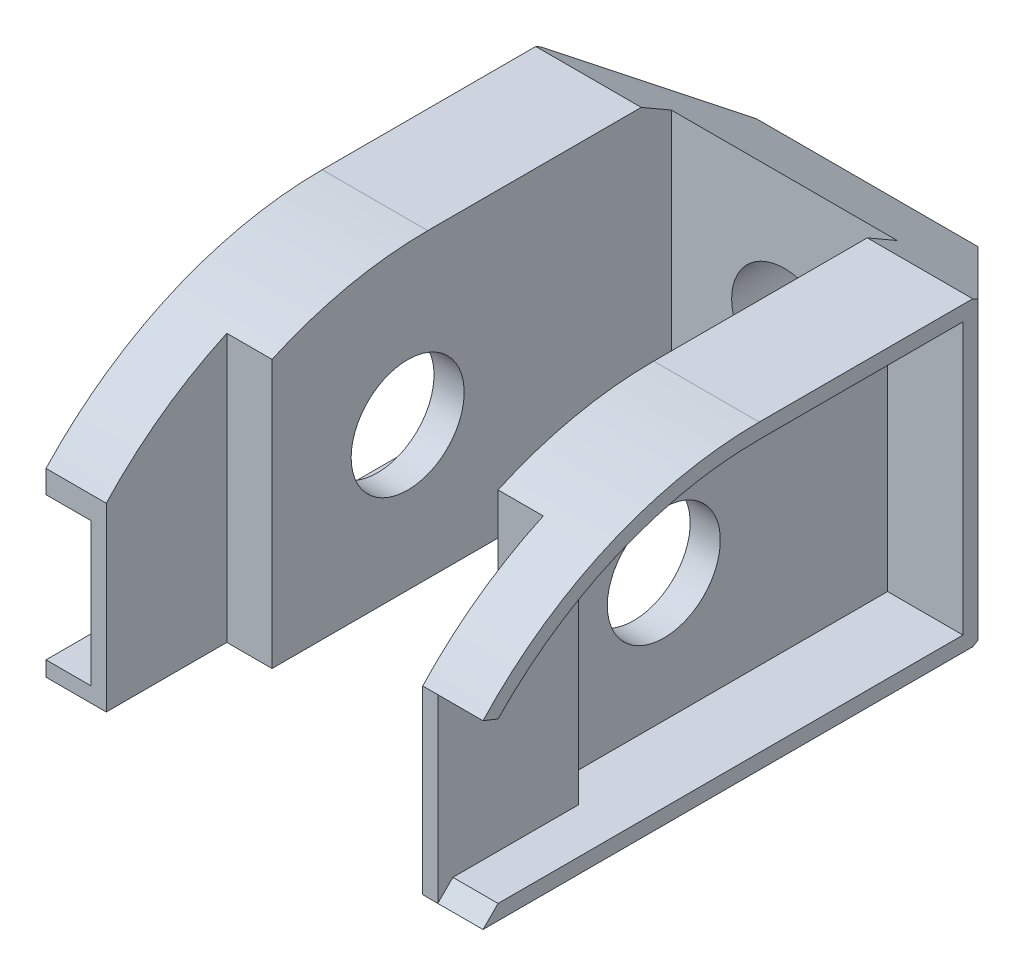
from build123d import *

# Parameters (mm, degrees)
SKETCH1_R                           = 7.5
BOSS_EXTRUDE1_DEPTH                 = 58
CUT_EXTRUDE1_DEPTH                  = 107.60206377
CUT_EXTRUDE1_DEPTH_BACK             = 10
SKETCH3_W                           = 30
SKETCH3_H                           = 53
CUT_EXTRUDE3_DEPTH                  = 107.60206377
CUT_EXTRUDE3_DIRECTION_2_REACH      = 108.602
CUT_EXTRUDE3_DIRECTION_2_END_RADIUS = 50
CUT_EXTRUDE4_DEPTH                  = 107.60206377
SKETCH8_R                           = 7
CUT_EXTRUDE5_DEPTH                  = 107.60206377
SKETCH10_R                          = 7.5
CUT_EXTRUDE6_DEPTH                  = 6
CUT_EXTRUDE7_DEPTH                  = 4
CUT_EXTRUDE9_START                  = -6
SKETCH12_R                          = 7.5
CUT_EXTRUDE9_DEPTH                  = 6
CUT_EXTRUDE10_START                 = -4
CUT_EXTRUDE10_DEPTH                 = 4


with BuildPart() as part:
    # Sketch1 → Boss-Extrude1 (new body)
    with BuildSketch(Plane(origin=(0, 0, 0), x_dir=(0, 0, -1), z_dir=(1, 0, 0))):
        with BuildLine():
            Line((0, 0), (65, 0))
            Line((65, 0), (80, 8.660254038))
            Line((80, 8.660254038), (80, 31.339745962))
            Line((80, 31.339745962), (65, 40))
            Line((65, 40), (36.66060556, 40))
            ThreePointArc((36.66060556, 40), (16.66060556, 35.82575695), (0, 24))
            Line((0, 24), (0, 0))
        make_face()
        with Locations(Location((34, 19, 0), (0, 0, 180))):
            Circle(SKETCH1_R, mode=Mode.SUBTRACT)
    extrude(amount=BOSS_EXTRUDE1_DEPTH)

    # Sketch3 → Cut-Extrude1 (cut, two sides: drawn at the far end of the back side and taken through both)
    with BuildSketch(Plane(origin=(0, 0, 0), x_dir=(1, 0, 0), z_dir=(0, 1, 0)).offset(-CUT_EXTRUDE1_DEPTH_BACK)):
        with Locations((29, 42.5)):
            Rectangle(SKETCH3_W, SKETCH3_H)
    extrude(amount=CUT_EXTRUDE1_DEPTH + CUT_EXTRUDE1_DEPTH_BACK, mode=Mode.SUBTRACT)

    # Sketch5 → Cut-Extrude3 (cut)
    with BuildSketch(Plane(origin=(0, 0, 0), x_dir=(1, 0, 0), z_dir=(0, 1, 0))):
        Polygon((29, 0), (29, 16), (14, 16), (8, 16), (8, 0), align=None)
        Polygon((44, 16), (29, 16), (29, 0), (50, 0), (50, 16), align=None)
    extrude(amount=-CUT_EXTRUDE3_DEPTH, mode=Mode.SUBTRACT)

    # Cut-Extrude3 direction 2: up to this cylinder (the profile starts inside it)
    cut_extrude3_direction_2_end = Plane(origin=(29, -10, -36.66060556), z_dir=(-1, 0, 0)) * Cylinder(CUT_EXTRUDE3_DIRECTION_2_END_RADIUS, 339.204, mode=Mode.PRIVATE)
    # Sketch5 → Cut-Extrude3 direction 2 (cut, up to the surface)
    with BuildSketch(Plane(origin=(0, 0, 0), x_dir=(1, 0, 0), z_dir=(0, 1, 0)), mode=Mode.PRIVATE) as cut_extrude3_direction_2_sk1:
        Polygon((29, 0), (29, 16), (14, 16), (8, 16), (8, 0), align=None)
    cut_extrude3_direction_2_tool1 = extrude(cut_extrude3_direction_2_sk1.sketch, amount=CUT_EXTRUDE3_DIRECTION_2_REACH, mode=Mode.PRIVATE) & cut_extrude3_direction_2_end
    add(cut_extrude3_direction_2_tool1.solids().sort_by_distance((18.5, 0, -8))[0], mode=Mode.SUBTRACT)
    # Sketch5 → Cut-Extrude3 direction 2 (cut, up to the surface)
    with BuildSketch(Plane(origin=(0, 0, 0), x_dir=(1, 0, 0), z_dir=(0, 1, 0)), mode=Mode.PRIVATE) as cut_extrude3_direction_2_sk2:
        Polygon((44, 16), (29, 16), (29, 0), (50, 0), (50, 16), align=None)
    cut_extrude3_direction_2_tool2 = extrude(cut_extrude3_direction_2_sk2.sketch, amount=CUT_EXTRUDE3_DIRECTION_2_REACH, mode=Mode.PRIVATE) & cut_extrude3_direction_2_end
    add(cut_extrude3_direction_2_tool2.solids().sort_by_distance((39.5, 0, -8))[0], mode=Mode.SUBTRACT)

    # Sketch7 → Cut-Extrude4 (cut, through all)
    with BuildSketch(Plane(origin=(0, 0, 0), x_dir=(1, 0, 0), z_dir=(0, 1, 0))):
        Polygon((0, 65.69666313), (14.30333687, 80), (0, 80), align=None)
        Polygon((58, 65.69666313), (43.69666313, 80), (58, 80), align=None)
    extrude(amount=CUT_EXTRUDE4_DEPTH, mode=Mode.SUBTRACT)

    # Sketch8 → Cut-Extrude5 (cut, through all)
    with BuildSketch(Plane(origin=(0, 0, -80), x_dir=(-1, 0, 0), z_dir=(0, 0, -1))):
        with Locations((-29, 20)):
            Circle(SKETCH8_R)
    extrude(amount=-CUT_EXTRUDE5_DEPTH, mode=Mode.SUBTRACT)

    # Sketch10 → Cut-Extrude6 (cut)
    with BuildSketch(Plane.ZY):
        with BuildLine():
            Line((-36.66060556, 38), (-63.69666313, 38))
            Line((-63.69666313, 38), (-63.69666313, 2))
            Line((-63.69666313, 2), (0, 2))
            Line((0, 2), (0, 20.98386677))
            ThreePointArc((0, 20.98386677), (-0.7236706, 21.820381922), (-1.466424222, 22.64))
            ThreePointArc((-1.466424222, 22.64), (-17.46060556, 33.992726672), (-36.66060556, 38))
        make_face()
        with Locations((-34, 19)):
            Circle(SKETCH10_R, mode=Mode.SUBTRACT)
    extrude(amount=-CUT_EXTRUDE6_DEPTH, mode=Mode.SUBTRACT)

    # Sketch11 → Cut-Extrude7 (cut)
    with BuildSketch(Plane.ZY.offset(-6)):
        with BuildLine():
            Line((-63.69666313, 2), (-63.69666313, 38))
            Line((-63.69666313, 38), (-36.66060556, 38))
            ThreePointArc((-36.66060556, 38), (-27.510864492, 37.119870951), (-18.69666313, 34.511759933))
            Line((-18.69666313, 34.511759933), (-18.69666313, 2))
            Line((-18.69666313, 2), (-63.69666313, 2))
        make_face()
    extrude(amount=-CUT_EXTRUDE7_DEPTH, mode=Mode.SUBTRACT)

    # Sketch12 → Cut-Extrude9 (cut)
    with BuildSketch(Plane(origin=(58, 0, 0), x_dir=(0, 0, -1), z_dir=(1, 0, 0)).offset(CUT_EXTRUDE9_START)):
        with BuildLine():
            Line((63.69666313, 38), (36.66060556, 38))
            ThreePointArc((36.66060556, 38), (17.817714076, 34.146862182), (2, 23.206060023))
            Line((2, 23.206060023), (0, 24))
            Line((0, 24), (0, 0))
            Line((0, 0), (2, 2))
            Line((2, 2), (63.69666313, 2))
            Line((63.69666313, 2), (63.69666313, 38))
        make_face()
        with Locations(Location((34, 19, 0), (0, 0, 180))):
            Circle(SKETCH12_R, mode=Mode.SUBTRACT)
    extrude(amount=CUT_EXTRUDE9_DEPTH, mode=Mode.SUBTRACT)

    # Sketch13 → Cut-Extrude10 (cut)
    with BuildSketch(Plane(origin=(52, 0, 0), x_dir=(0, 0, -1), z_dir=(1, 0, 0)).offset(CUT_EXTRUDE10_START)):
        with BuildLine():
            Line((18.69666313, 34.511759933), (18.69666313, 2))
            Line((18.69666313, 2), (63.69666313, 2))
            Line((63.69666313, 2), (63.69666313, 38))
            Line((63.69666313, 38), (36.66060556, 38))
            ThreePointArc((36.66060556, 38), (27.510864492, 37.119870951), (18.69666313, 34.511759933))
        make_face()
    extrude(amount=CUT_EXTRUDE10_DEPTH, mode=Mode.SUBTRACT)


solid = part.part
